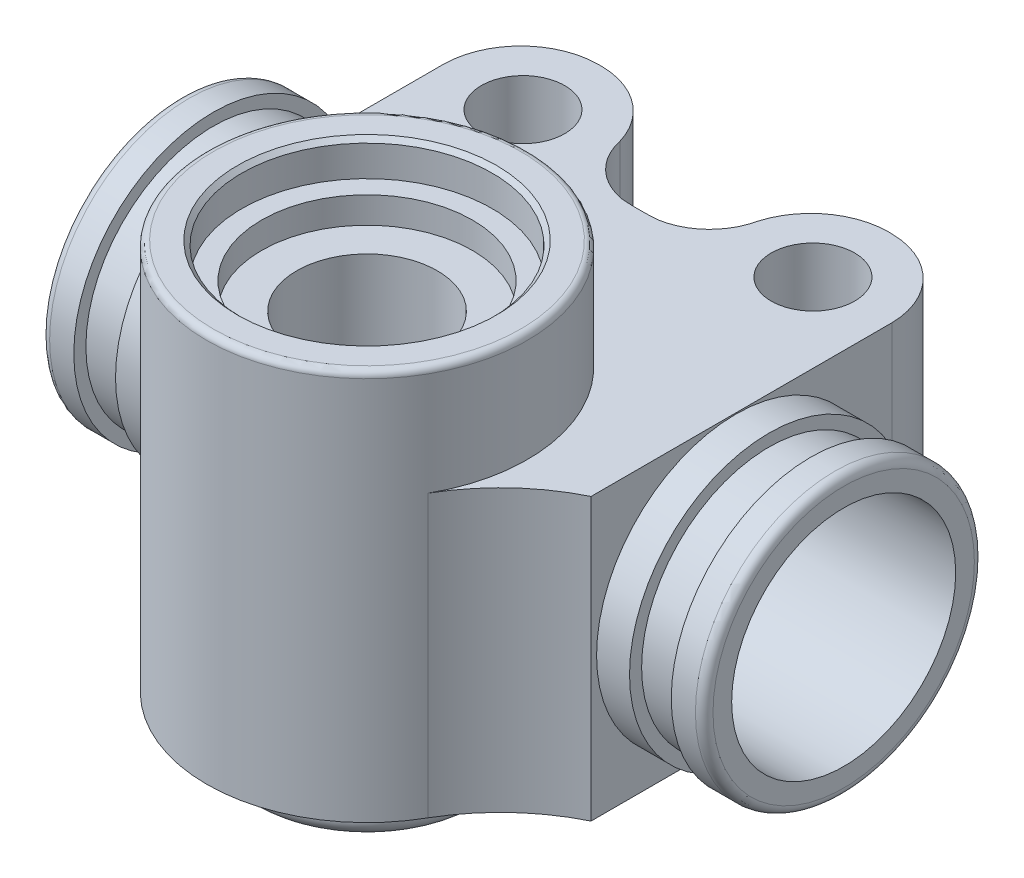
from build123d import *

# Parameters (mm, degrees)
SKETCH1_R            = 18.25
BOSS_EXTRUDE1_DEPTH  = 44.5
BOSS_EXTRUDE2_DEPTH  = 32
SKETCH3_R            = 4.75
CUT_EXTRUDE2_DEPTH   = 32
CUT_EXTRUDE3_DEPTH   = 32
SKETCH5_R            = 14.25
CUT_EXTRUDE4_DEPTH   = 4
CHAMFER1_SIZE        = 0.5
FILLET1_R            = 0.75
SKETCH6_R            = 12
CUT_EXTRUDE5_DEPTH   = 3
SKETCH7_R            = 13
BOSS_EXTRUDE3_DEPTH  = 5.5
FILLET2_R            = 1.8
SKETCH8_R            = 15.875
BOSS_EXTRUDE4_DEPTH  = 3.75
SKETCH9_R            = 14.5
BOSS_EXTRUDE5_DEPTH  = 4.75
SKETCH10_R           = 15.875
BOSS_EXTRUDE6_DEPTH  = 3.75
FILLET3_R            = 1
FILLET3_OF_MIRROR1_R = 1
SKETCH11_R           = 12.75
CUT_EXTRUDE6_DEPTH   = 79.75
SKETCH12_R           = 8
CUT_EXTRUDE7_DEPTH   = 32.75


with BuildPart() as part:
    # Sketch1 → Boss-Extrude1 (new body)
    with BuildSketch(Plane(origin=(0, 0, 0), x_dir=(1, 0, 0), z_dir=(0, 1, 0))):
        Circle(SKETCH1_R)
    extrude(amount=BOSS_EXTRUDE1_DEPTH)

    # Sketch2 → Boss-Extrude2 (add)
    with BuildSketch(Plane.XZ):
        with BuildLine():
            Line((25.5, 0), (25.5, -43))
            Line((25.5, -43), (-25.5, -43))
            Line((-25.5, -43), (-25.5, 0))
            ThreePointArc((-25.5, 0), (-20.032746784, 3.769396236), (-15.896474532, 8.964630358))
            ThreePointArc((-15.896474532, 8.964630358), (0, -18.25), (15.896474532, 8.964630358))
            ThreePointArc((15.896474532, 8.964630358), (20.032746784, 3.769396236), (25.5, 0))
        make_face()
    extrude(amount=-BOSS_EXTRUDE2_DEPTH)

    # Sketch3 → Cut-Extrude2 (cut)
    with BuildSketch(Plane(origin=(0, 32, 0), x_dir=(1, 0, 0), z_dir=(0, 1, 0))):
        with Locations((-16.5, 34.25)):
            Circle(SKETCH3_R)
        with Locations((16.5, 34.25)):
            Circle(SKETCH3_R)
    extrude(amount=-CUT_EXTRUDE2_DEPTH, mode=Mode.SUBTRACT)

    # Sketch4 → Cut-Extrude3 (cut)
    with BuildSketch(Plane(origin=(0, 32, 0), x_dir=(1, 0, 0), z_dir=(0, 1, 0))):
        with BuildLine():
            Line((25.5, 43), (16.75, 43))
            ThreePointArc((16.75, 43), (22.901195105, 40.401195105), (25.5, 34.25))
            Line((25.5, 34.25), (25.5, 43))
        make_face()
        with BuildLine():
            Line((16.25, 43), (-16.25, 43))
            ThreePointArc((-16.25, 43), (-11.008714433, 41.194952561), (-7.860592425, 36.632212324))
            ThreePointArc((-7.860592425, 36.632212324), (-5.818294481, 32.970747376), (-2.07874831, 31.075199726))
            ThreePointArc((-2.07874831, 31.075199726), (-1.040129155, 31.016729364), (0, 31))
            ThreePointArc((0, 31), (1.040129155, 31.016729364), (2.07874831, 31.075199726))
            ThreePointArc((2.07874831, 31.075199726), (5.818294481, 32.970747376), (7.860592425, 36.632212324))
            ThreePointArc((7.860592425, 36.632212324), (11.008714433, 41.194952561), (16.25, 43))
        make_face()
        with BuildLine():
            Line((-16.75, 43), (-25.5, 43))
            Line((-25.5, 43), (-25.5, 34.25))
            ThreePointArc((-25.5, 34.25), (-22.901195105, 40.401195105), (-16.75, 43))
        make_face()
    extrude(amount=-CUT_EXTRUDE3_DEPTH, mode=Mode.SUBTRACT)

    # Sketch5 → Cut-Extrude4 (cut)
    with BuildSketch(Plane(origin=(0, 44.5, 0), x_dir=(1, 0, 0), z_dir=(0, 1, 0))):
        Circle(SKETCH5_R)
    extrude(amount=-CUT_EXTRUDE4_DEPTH, mode=Mode.SUBTRACT)

    # Chamfer1
    chamfer1_edges = [part.edges().sort_by_distance(p)[0] for p in [
        (-14.25, 44.5, 0),
    ]]
    chamfer(chamfer1_edges, length=CHAMFER1_SIZE)

    # Fillet1
    fillet1_edges = [part.edges().sort_by_distance(p)[0] for p in [
        (-18.25, 44.5, 0),
    ]]
    fillet(fillet1_edges, radius=FILLET1_R)

    # Sketch6 → Cut-Extrude5 (cut)
    with BuildSketch(Plane(origin=(0, 40.5, 0), x_dir=(1, 0, 0), z_dir=(0, 1, 0))):
        Circle(SKETCH6_R)
    extrude(amount=-CUT_EXTRUDE5_DEPTH, mode=Mode.SUBTRACT)

    # Sketch7 → Boss-Extrude3 (add)
    with BuildSketch(Plane.XZ):
        Circle(SKETCH7_R)
    extrude(amount=BOSS_EXTRUDE3_DEPTH)

    # Fillet2
    fillet2_edges = [part.edges().sort_by_distance(p)[0] for p in [
        (-13, -5.5, 0),
    ]]
    fillet(fillet2_edges, radius=FILLET2_R)

    # Sketch8 → Boss-Extrude4 (add)
    with BuildSketch(Plane.ZY.offset(25.5)):
        with Locations((-16.5, 16)):
            Circle(SKETCH8_R)
    boss_extrude4 = extrude(amount=BOSS_EXTRUDE4_DEPTH)

    # Sketch9 → Boss-Extrude5 (add)
    with BuildSketch(Plane.ZY.offset(29.25)):
        with Locations((-16.5, 16)):
            Circle(SKETCH9_R)
    boss_extrude5 = extrude(amount=BOSS_EXTRUDE5_DEPTH)

    # Sketch10 → Boss-Extrude6 (add)
    with BuildSketch(Plane.ZY.offset(34)):
        with Locations((-16.5, 16)):
            Circle(SKETCH10_R)
    boss_extrude6 = extrude(amount=BOSS_EXTRUDE6_DEPTH)

    # Fillet3
    fillet3_edges = [part.edges().sort_by_distance(p)[0] for p in [
        (-37.75, 16, -32.375),
    ]]
    fillet(fillet3_edges, radius=FILLET3_R)

    # Mirror1: Boss-Extrude4, Boss-Extrude5, Boss-Extrude6 across plane
    add(boss_extrude4.mirror(Plane(origin=(0, 0, 0), x_dir=(0, 0, 1), z_dir=(1, 0, 0))))
    add(boss_extrude5.mirror(Plane(origin=(0, 0, 0), x_dir=(0, 0, 1), z_dir=(1, 0, 0))))
    add(boss_extrude6.mirror(Plane(origin=(0, 0, 0), x_dir=(0, 0, 1), z_dir=(1, 0, 0))))

    # Fillet3 of Mirror1
    fillet3_of_mirror1_edges = [part.edges().sort_by_distance(p)[0] for p in [
        (37.75, 16, -32.375),
    ]]
    fillet(fillet3_of_mirror1_edges, radius=FILLET3_OF_MIRROR1_R)

    # Sketch11 → Cut-Extrude6 (cut)
    with BuildSketch(Plane.ZY.offset(37.75)):
        with Locations((-16.5, 16)):
            Circle(SKETCH11_R)
    extrude(amount=-CUT_EXTRUDE6_DEPTH, mode=Mode.SUBTRACT)

    # Sketch12 → Cut-Extrude7 (cut)
    with BuildSketch(Plane(origin=(0, 37.5, 0), x_dir=(1, 0, 0), z_dir=(0, 1, 0))):
        Circle(SKETCH12_R)
    extrude(amount=-CUT_EXTRUDE7_DEPTH, mode=Mode.SUBTRACT)


solid = part.part
